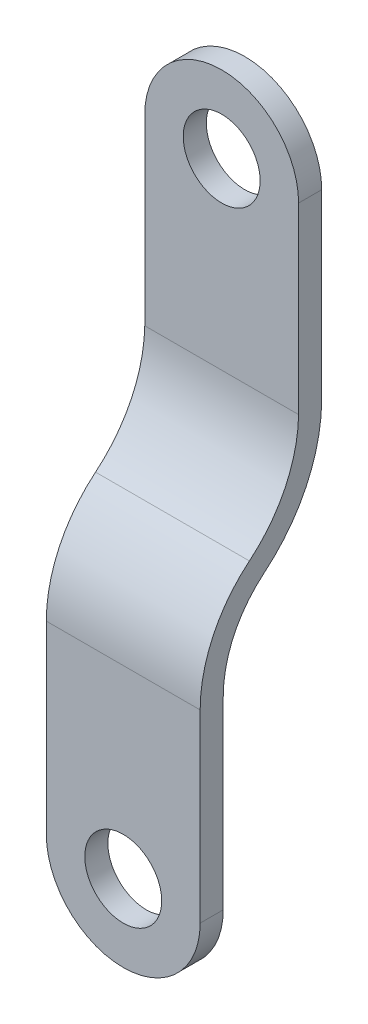
from build123d import *

# Parameters (mm, degrees)
BRACKET_BASE_DEPTH = 5
SKETCH7_R          = 5
RADIUS_1_DEPTH     = 1.5
SKETCH8_R          = 5
RADIUS_2_DEPTH     = 1.5
SKETCH9_R          = 2.5
HOLES_DEPTH        = 44.354217003


with BuildPart() as part:
    # Sketch4 → Bracket Base (new, symmetric)
    with BuildSketch(Plane(origin=(0, 0, 0), x_dir=(0, 0, -1), z_dir=(1, 0, 0))):
        with BuildLine():
            Line((1.5, 0), (1.5, 12))
            ThreePointArc((1.5, 12), (2.196870508, 15.112089987), (4.154386337, 17.629800131))
            ThreePointArc((4.154386337, 17.629800131), (6.88214507, 21.110113004), (7.898749765, 25.413572113))
            Line((7.898749765, 25.413572113), (7.898749765, 37.334358198))
            Line((7.898749765, 37.334358198), (6.398749765, 37.334358198))
            Line((6.398749765, 37.334358198), (6.398749765, 25.425719387))
            ThreePointArc((6.398749765, 25.425719387), (5.527978098, 21.755301891), (3.2, 18.787015202))
            ThreePointArc((3.2, 18.787015202), (0.840113436, 15.75178542), (0, 12))
            Line((0, 12), (0, 0))
            Line((0, 0), (1.5, 0))
        make_face()
    extrude(amount=BRACKET_BASE_DEPTH, both=True)

    # Sketch7 → Radius 1 (add)
    with BuildSketch(Plane.XY):
        Circle(SKETCH7_R)
    extrude(amount=-RADIUS_1_DEPTH)

    # Sketch8 → Radius 2 (add)
    with BuildSketch(Plane.XY.offset(-6.398749765)):
        with Locations((0, 37.334358198)):
            Circle(SKETCH8_R)
    extrude(amount=-RADIUS_2_DEPTH)

    # Sketch9 → Holes (cut, through all)
    with BuildSketch(Plane.XY):
        Circle(SKETCH9_R)
        with Locations((0, 37.334358198)):
            Circle(SKETCH9_R)
    extrude(amount=-HOLES_DEPTH, mode=Mode.SUBTRACT)


solid = part.part
